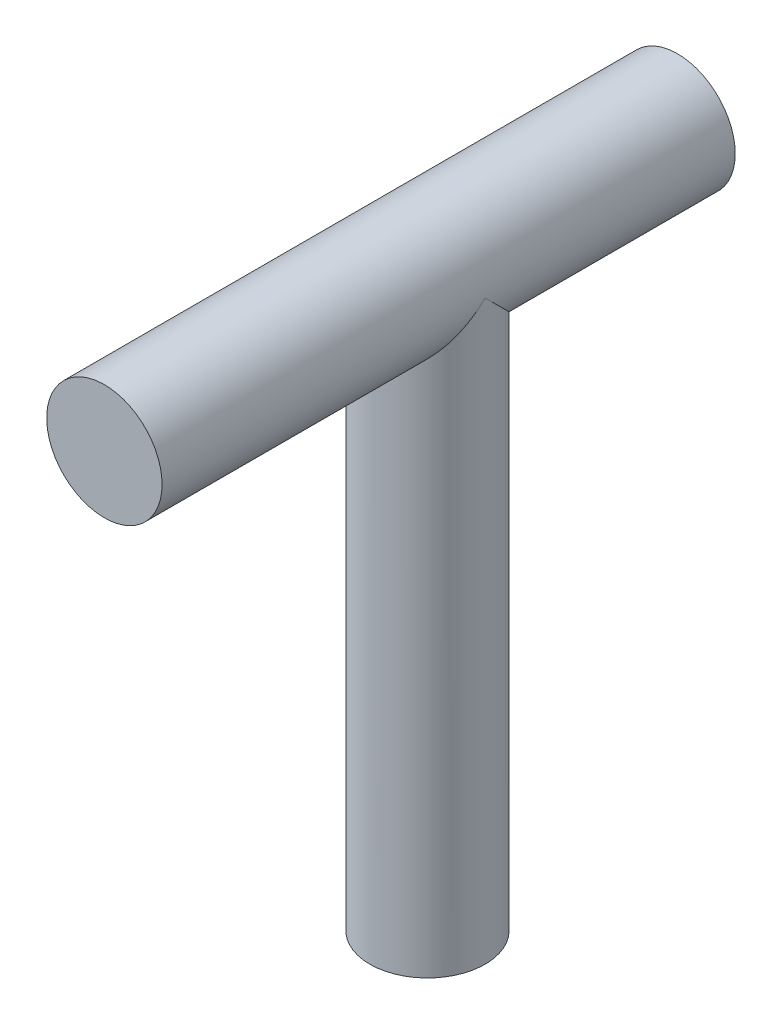
from build123d import *

# Parameters (mm, degrees)
SKETCH_2_R           = 15
EXTRUDE_1_DEPTH      = 150
EXTRUDE_2_DEPTH      = 84
EXTRUDE_2_DEPTH_BACK = 65
SKETCH_3_R           = 15


with BuildPart() as part:
    # Эскиз2 → Бобышка-Вытянуть1 (new body)
    with BuildSketch(Plane(origin=(0, 0, 0), x_dir=(1, 0, 0), z_dir=(0, 1, 0))):
        with Locations(Location((0, 0, 0), (0, 0, 270))):
            Circle(SKETCH_2_R)
    extrude(amount=EXTRUDE_1_DEPTH)

    # Эскиз3 → Бобышка-Вытянуть2 (add, two sides: drawn at the far end of the back side and taken through both)
    with BuildSketch(Plane.XY.offset(-EXTRUDE_2_DEPTH_BACK)):
        with Locations((0, 150)):
            Circle(SKETCH_3_R)
    extrude(amount=EXTRUDE_2_DEPTH + EXTRUDE_2_DEPTH_BACK)


solid = part.part
